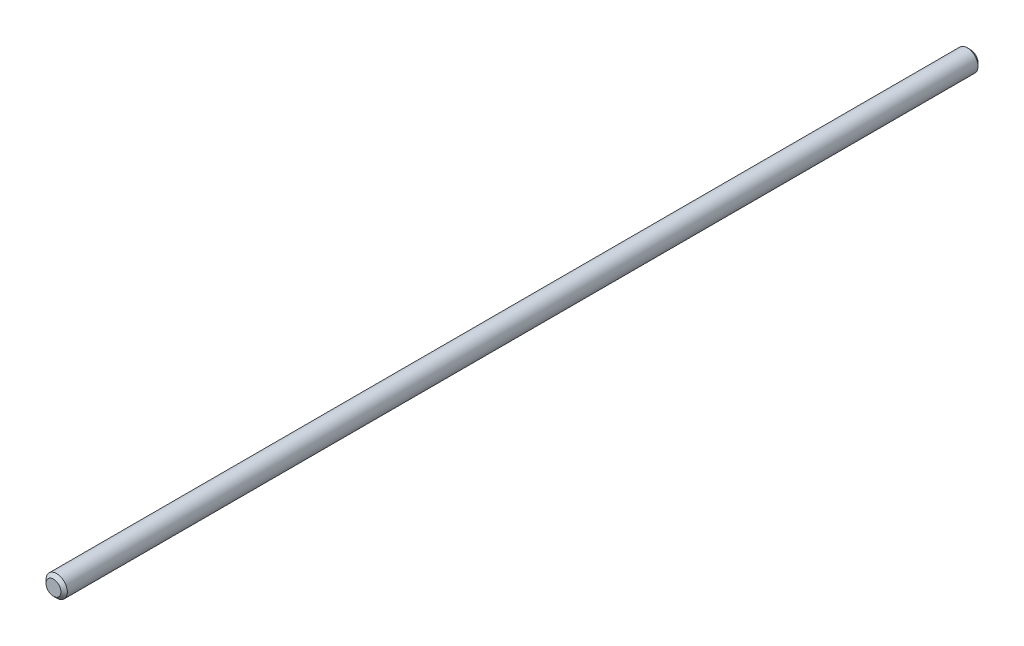
from build123d import *

# Parameters (mm, degrees)
BOSS_EXTRUDE1_DEPTH      = 136.525
BOSS_EXTRUDE1_DEPTH_BACK = 136.525
SKETCH2_R                = 3.175
CHAMFER1_SIZE            = 0.9525


with BuildPart() as part:
    # Sketch2 → Boss-Extrude1 (new, two sides: drawn at the far end of the back side and taken through both)
    with BuildSketch(Plane.XY.offset(-BOSS_EXTRUDE1_DEPTH_BACK)):
        Circle(SKETCH2_R)
    extrude(amount=BOSS_EXTRUDE1_DEPTH + BOSS_EXTRUDE1_DEPTH_BACK)

    # Chamfer1
    chamfer1_edges = [part.edges().sort_by_distance(p)[0] for p in [
        (-3.175, 0, -136.525),
        (-3.175, 0, 136.525),
    ]]
    chamfer(chamfer1_edges, length=CHAMFER1_SIZE)


solid = part.part
